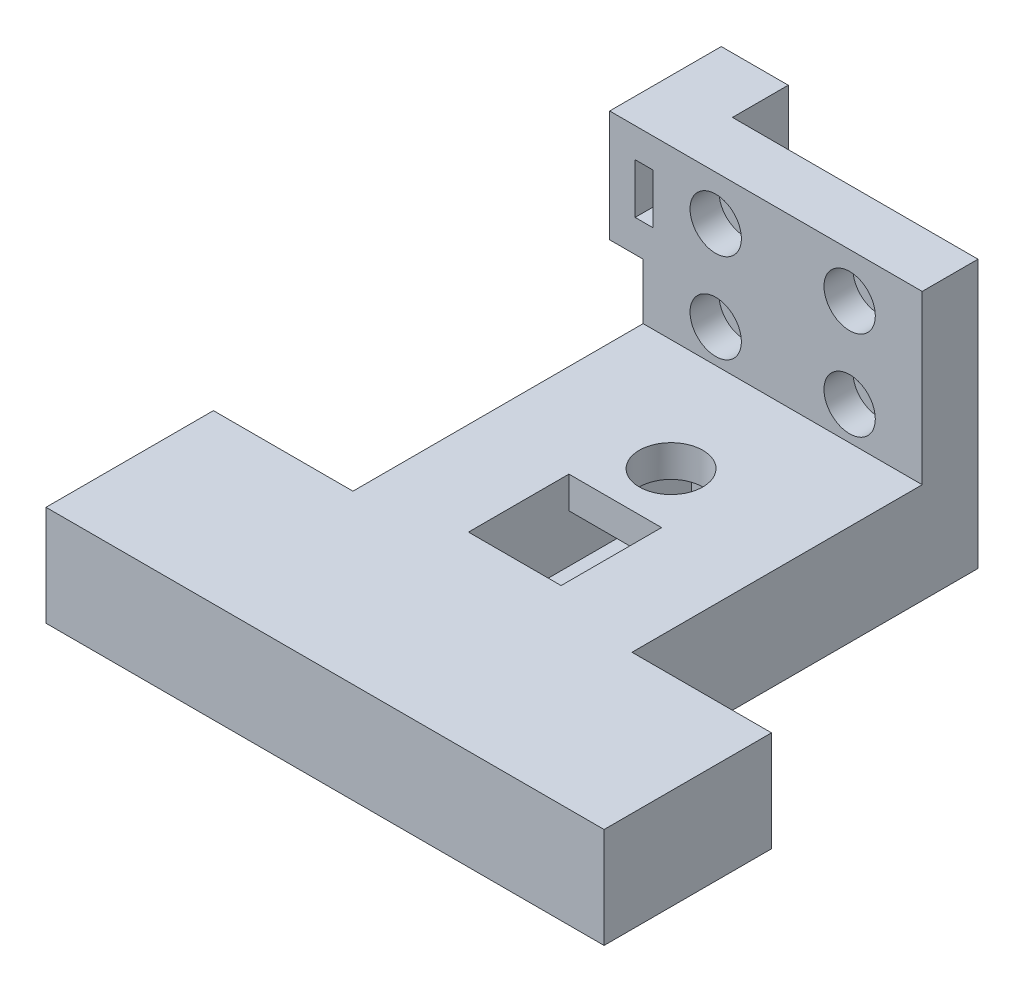
from build123d import *

# Parameters (mm, degrees)
SKETCH1_W                      = 25
SKETCH1_H                      = 25
BOSS_EXTRUDE1_DEPTH            = 5
CBORE_FOR_M2_SHCS1_D           = 2.6
CBORE_FOR_M2_SHCS1_CBORE_D     = 4.6
CBORE_FOR_M2_SHCS1_CBORE_DEPTH = 2.6
SKETCH5_W                      = 25
SKETCH5_H                      = 10
BOSS_EXTRUDE2_DEPTH            = 26
SKETCH6_R                      = 2.85
CUT_EXTRUDE1_DEPTH             = 43.555845662
SKETCH7_W                      = 8.3
SKETCH7_H                      = 4.3
CUT_EXTRUDE2_DEPTH             = 22
SKETCH8_W                      = 8.3
SKETCH8_H                      = 9
CUT_EXTRUDE3_DEPTH             = 2.85
SKETCH7_2_W                    = 8.3
SKETCH7_2_H                    = 4.3
BOSS_EXTRUDE5_DEPTH            = 2
SKETCH9_W                      = 50
SKETCH9_H                      = 10
BOSS_EXTRUDE3_DEPTH            = 20
SKETCH10_W                     = 50
SKETCH10_H                     = 7
CUT_EXTRUDE4_DEPTH             = 66.055745327
SKETCH11_W                     = 5
SKETCH11_H                     = 25
BOSS_EXTRUDE6_DEPTH            = 3
SKETCH12_W                     = 3
SKETCH12_H                     = 15
CUT_EXTRUDE5_DEPTH             = 60.600755029
SKETCH13_W                     = 6
SKETCH13_H                     = 10
BOSS_EXTRUDE7_DEPTH            = 5
SKETCH14_W                     = 1.219
SKETCH14_H                     = 4.08
CUT_EXTRUDE6_DEPTH             = 60.600755029
SKETCH15_W                     = 1.619
SKETCH15_H                     = 4.48
CUT_EXTRUDE7_DEPTH             = 60.600755029
SKETCH16_W                     = 50
SKETCH16_H                     = 10
BOSS_EXTRUDE8_DEPTH            = 2
CHAMFER1_SIZE                  = 1


with BuildPart() as part:
    # Sketch1 → Boss-Extrude1 (new body)
    with BuildSketch(Plane.XY):
        with Locations((12.5, 12.5)):
            Rectangle(SKETCH1_W, SKETCH1_H)
    extrude(amount=BOSS_EXTRUDE1_DEPTH)

    # CBORE for M2 SHCS1 (through all)
    with Locations(Plane.XY.offset(5)):
        with Locations((6.5, 21), (18.5, 21), (18.5, 13), (6.5, 13)):
            CounterBoreHole(CBORE_FOR_M2_SHCS1_D / 2, CBORE_FOR_M2_SHCS1_CBORE_D / 2, CBORE_FOR_M2_SHCS1_CBORE_DEPTH)

    # Sketch5 → Boss-Extrude2 (add)
    with BuildSketch(Plane.XY.offset(5)):
        with Locations((12.5, 5)):
            Rectangle(SKETCH5_W, SKETCH5_H)
    extrude(amount=BOSS_EXTRUDE2_DEPTH)

    # Sketch6 → Cut-Extrude1 (cut, through all)
    with BuildSketch(Plane(origin=(0, 10, 0), x_dir=(1, 0, 0), z_dir=(0, 1, 0))):
        with Locations(Location((12.5, -15, 0), (0, 0, 270))):
            Circle(SKETCH6_R)
    extrude(amount=-CUT_EXTRUDE1_DEPTH, mode=Mode.SUBTRACT)

    # Sketch7 → Cut-Extrude2 (cut)
    with BuildSketch(Plane.XY.offset(31)):
        with Locations((12.5, 5)):
            Rectangle(SKETCH7_W, SKETCH7_H)
    extrude(amount=-CUT_EXTRUDE2_DEPTH, mode=Mode.SUBTRACT)

    # Sketch8 → Cut-Extrude3 (cut)
    with BuildSketch(Plane(origin=(0, 10, 0), x_dir=(1, 0, 0), z_dir=(0, 1, 0))):
        with Locations((12.5, -24.5)):
            Rectangle(SKETCH8_W, SKETCH8_H)
    extrude(amount=-CUT_EXTRUDE3_DEPTH, mode=Mode.SUBTRACT)

    # Sketch7<2> → Boss-Extrude5 (add)
    with BuildSketch(Plane.XY.offset(31)):
        with Locations((12.5, 5)):
            Rectangle(SKETCH7_2_W, SKETCH7_2_H)
    extrude(amount=-BOSS_EXTRUDE5_DEPTH)

    # Sketch9 → Boss-Extrude3 (add)
    with BuildSketch(Plane.XY.offset(31)):
        with Locations((12.5, 5)):
            Rectangle(SKETCH9_W, SKETCH9_H)
    extrude(amount=BOSS_EXTRUDE3_DEPTH)

    # Sketch10 → Cut-Extrude4 (cut, through all)
    with BuildSketch(Plane(origin=(0, 10, 0), x_dir=(1, 0, 0), z_dir=(0, 1, 0))):
        with Locations((12.5, -47.5)):
            Rectangle(SKETCH10_W, SKETCH10_H)
    extrude(amount=-CUT_EXTRUDE4_DEPTH, mode=Mode.SUBTRACT)

    # Sketch11 → Boss-Extrude6 (add)
    with BuildSketch(Plane.ZY):
        with Locations((2.5, 12.5)):
            Rectangle(SKETCH11_W, SKETCH11_H)
    extrude(amount=BOSS_EXTRUDE6_DEPTH)

    # Sketch12 → Cut-Extrude5 (cut, through all)
    with BuildSketch(Plane.XY.offset(5)):
        with Locations((-1.5, 7.5)):
            Rectangle(SKETCH12_W, SKETCH12_H)
    extrude(amount=-CUT_EXTRUDE5_DEPTH, mode=Mode.SUBTRACT)

    # Sketch13 → Boss-Extrude7 (add)
    with BuildSketch(Plane(origin=(0, 0, 0), x_dir=(-1, 0, 0), z_dir=(0, 0, -1))):
        with Locations((0, 20)):
            Rectangle(SKETCH13_W, SKETCH13_H)
    extrude(amount=BOSS_EXTRUDE7_DEPTH)

    # Sketch14 → Cut-Extrude6 (cut, through all)
    with BuildSketch(Plane.XY.offset(5)):
        with Locations((0.0895, 20.12)):
            Rectangle(SKETCH14_W, SKETCH14_H)
    extrude(amount=-CUT_EXTRUDE6_DEPTH, mode=Mode.SUBTRACT)

    # Sketch15 → Cut-Extrude7 (cut, through all)
    with BuildSketch(Plane.XY.offset(5)):
        with Locations((0.0895, 20.12)):
            Rectangle(SKETCH15_W, SKETCH15_H)
    extrude(amount=-CUT_EXTRUDE7_DEPTH, mode=Mode.SUBTRACT)

    # Sketch16 → Boss-Extrude8 (add)
    with BuildSketch(Plane.XY.offset(44)):
        with Locations((12.5, 5)):
            Rectangle(SKETCH16_W, SKETCH16_H)
    extrude(amount=BOSS_EXTRUDE8_DEPTH)

    # Chamfer1
    chamfer1_edges = [part.edges().sort_by_distance(p)[0] for p in [
        (-6.25, 0, 31),
        (31.25, 0, 31),
        (37.5, 0, 38.5),
        (-12.5, 0, 38.5),
        (12.5, 0, 0),
        (12.5, 0, 46),
        (25, 0, 15.5),
        (0, 0, 15.5),
    ]]
    chamfer(chamfer1_edges, length=CHAMFER1_SIZE)


solid = part.part
